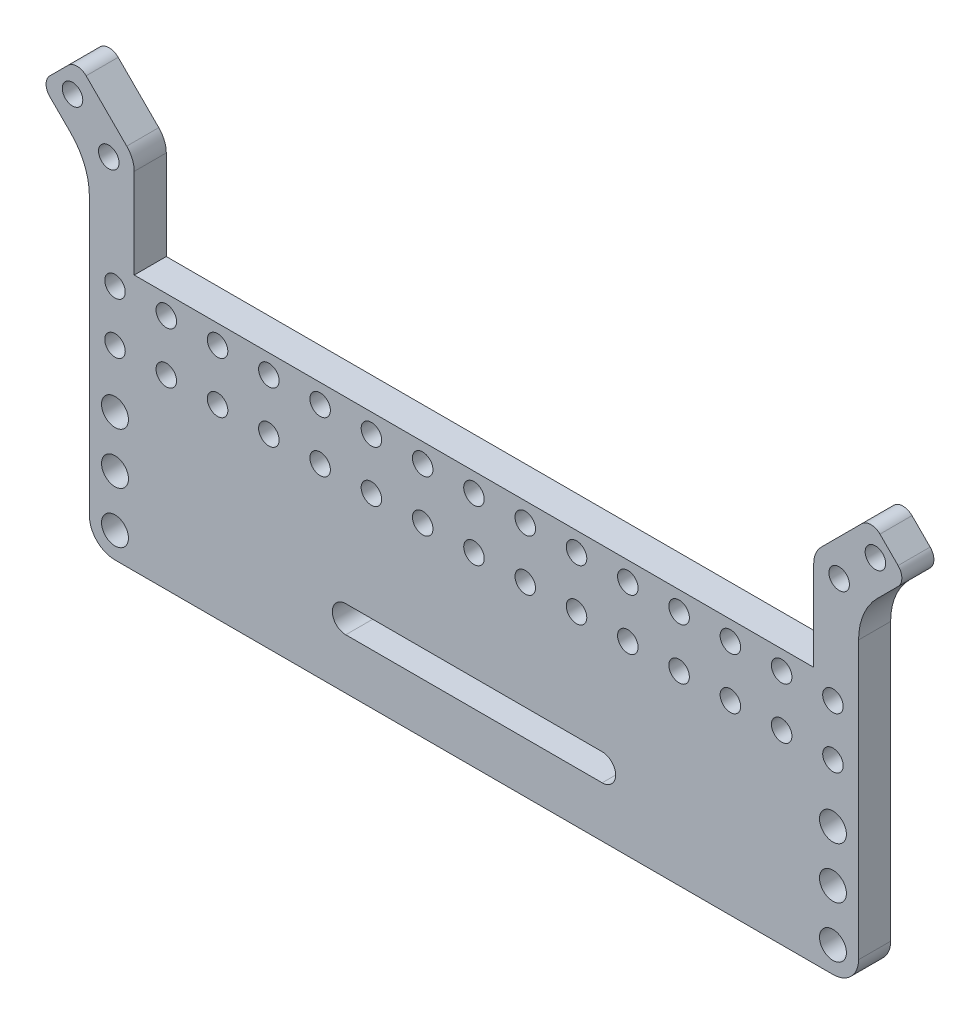
from build123d import *

# Parameters (mm, degrees)
SKETCH_2_R      = 1.6
SKETCH_2_R_2    = 2.1
EXTRUDE_3_DEPTH = 5
FILLET_1_R      = 4
FILLET_2_R      = 10
FILLET_3_R      = 2


with BuildPart() as part:
    # 草图2 → 凸台-拉伸3 (new body)
    with BuildSketch(Plane.XY):
        Polygon((-53, 20), (53, 20), (53, 35.656854249), (61.920310217, 44.577164466), (67.577164466, 38.920310217), (60, 31.34314575), (60, 20), (60, -20), (-60, -20), (-60, 20), (-60, 31.34314575), (-67.577164466, 38.920310217), (-61.920310217, 44.577164466), (-53, 35.656854249), align=None)
        with Locations((-56, 17)):
            Circle(SKETCH_2_R, mode=Mode.SUBTRACT)
        with Locations((-48, 17)):
            Circle(SKETCH_2_R, mode=Mode.SUBTRACT)
        with Locations((-40, 17)):
            Circle(SKETCH_2_R, mode=Mode.SUBTRACT)
        with Locations((-32, 17)):
            Circle(SKETCH_2_R, mode=Mode.SUBTRACT)
        with Locations((-24, 17)):
            Circle(SKETCH_2_R, mode=Mode.SUBTRACT)
        with Locations((-16, 17)):
            Circle(SKETCH_2_R, mode=Mode.SUBTRACT)
        with Locations((-8, 17)):
            Circle(SKETCH_2_R, mode=Mode.SUBTRACT)
        with Locations((0, 17)):
            Circle(SKETCH_2_R, mode=Mode.SUBTRACT)
        with Locations((8, 17)):
            Circle(SKETCH_2_R, mode=Mode.SUBTRACT)
        with Locations((16, 17)):
            Circle(SKETCH_2_R, mode=Mode.SUBTRACT)
        with Locations((24, 17)):
            Circle(SKETCH_2_R, mode=Mode.SUBTRACT)
        with Locations((32, 17)):
            Circle(SKETCH_2_R, mode=Mode.SUBTRACT)
        with Locations((40, 17)):
            Circle(SKETCH_2_R, mode=Mode.SUBTRACT)
        with Locations((48, 17)):
            Circle(SKETCH_2_R, mode=Mode.SUBTRACT)
        with Locations((56, 17)):
            Circle(SKETCH_2_R, mode=Mode.SUBTRACT)
        with Locations((-62.627416998, 39.627416998)):
            Circle(SKETCH_2_R, mode=Mode.SUBTRACT)
        with Locations(Location((62.627416998, 39.627416998, 0), (0, 0, 180))):
            Circle(SKETCH_2_R, mode=Mode.SUBTRACT)
        with Locations((-56, 9)):
            Circle(SKETCH_2_R, mode=Mode.SUBTRACT)
        with Locations((-48, 9)):
            Circle(SKETCH_2_R, mode=Mode.SUBTRACT)
        with Locations((-40, 9)):
            Circle(SKETCH_2_R, mode=Mode.SUBTRACT)
        with Locations((-32, 9)):
            Circle(SKETCH_2_R, mode=Mode.SUBTRACT)
        with Locations((-24, 9)):
            Circle(SKETCH_2_R, mode=Mode.SUBTRACT)
        with Locations((-16, 9)):
            Circle(SKETCH_2_R, mode=Mode.SUBTRACT)
        with Locations((-8, 9)):
            Circle(SKETCH_2_R, mode=Mode.SUBTRACT)
        with Locations((0, 9)):
            Circle(SKETCH_2_R, mode=Mode.SUBTRACT)
        with Locations((8, 9)):
            Circle(SKETCH_2_R, mode=Mode.SUBTRACT)
        with Locations((16, 9)):
            Circle(SKETCH_2_R, mode=Mode.SUBTRACT)
        with Locations((24, 9)):
            Circle(SKETCH_2_R, mode=Mode.SUBTRACT)
        with Locations((32, 9)):
            Circle(SKETCH_2_R, mode=Mode.SUBTRACT)
        with Locations((40, 9)):
            Circle(SKETCH_2_R, mode=Mode.SUBTRACT)
        with Locations((48, 9)):
            Circle(SKETCH_2_R, mode=Mode.SUBTRACT)
        with Locations((56, 9)):
            Circle(SKETCH_2_R, mode=Mode.SUBTRACT)
        with Locations((-56, -16)):
            Circle(SKETCH_2_R_2, mode=Mode.SUBTRACT)
        with Locations((-56, -8)):
            Circle(SKETCH_2_R_2, mode=Mode.SUBTRACT)
        with Locations((-56, 0)):
            Circle(SKETCH_2_R_2, mode=Mode.SUBTRACT)
        with Locations(Location((56, -16, 0), (0, 0, 180))):
            Circle(SKETCH_2_R_2, mode=Mode.SUBTRACT)
        with Locations(Location((56, -8, 0), (0, 0, 180))):
            Circle(SKETCH_2_R_2, mode=Mode.SUBTRACT)
        with Locations(Location((56, 0, 0), (0, 0, 180))):
            Circle(SKETCH_2_R_2, mode=Mode.SUBTRACT)
        with Locations((-56.970562748, 33.970562748)):
            Circle(SKETCH_2_R, mode=Mode.SUBTRACT)
        with Locations(Location((56.970562748, 33.970562748, 0), (0, 0, 180))):
            Circle(SKETCH_2_R, mode=Mode.SUBTRACT)
        with BuildLine():
            Line((-20, -7.9), (20, -7.9))
            ThreePointArc((20, -7.9), (22.1, -10), (20, -12.1))
            Line((20, -12.1), (-20, -12.1))
            ThreePointArc((-20, -12.1), (-22.1, -10), (-20, -7.9))
        make_face(mode=Mode.SUBTRACT)
    extrude(amount=EXTRUDE_3_DEPTH)

    # 圆角1
    fillet_1_edges = [part.edges().sort_by_distance(p)[0] for p in [
        (60, -20, 2.5),
        (-60, -20, 2.5),
        (-53, 35.656854249, 2.5),
        (53, 35.656854249, 2.5),
    ]]
    fillet(fillet_1_edges, radius=FILLET_1_R)

    # 圆角2
    fillet_2_edges = [part.edges().sort_by_distance(p)[0] for p in [
        (-60, 31.34314575, 2.5),
        (60, 31.34314575, 2.5),
    ]]
    fillet(fillet_2_edges, radius=FILLET_2_R)

    # 圆角3
    fillet_3_edges = [part.edges().sort_by_distance(p)[0] for p in [
        (-67.577164466, 38.920310217, 2.5),
        (-61.920310217, 44.577164466, 2.5),
        (61.920310217, 44.577164466, 2.5),
        (67.577164466, 38.920310217, 2.5),
    ]]
    fillet(fillet_3_edges, radius=FILLET_3_R)


solid = part.part
